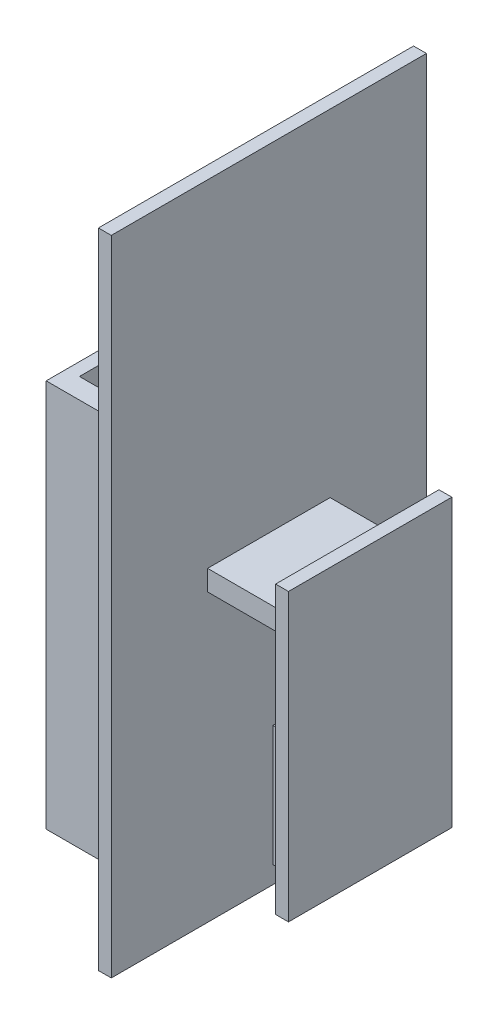
from build123d import *

# Parameters (mm, degrees)
EXTRUDE_1_DEPTH      = 0.8
EXTRUDE_1_DEPTH_BACK = 0.8
SKETCH_1_W           = 39.2
SKETCH_1_H           = 80
SKETCH_1_3_W         = 15.24
SKETCH_1_3_H         = 2.54
EXTRUDE_2_DEPTH      = 11.8
SKETCH_2_W           = 20.32
SKETCH_2_H           = 35.6
EXTRUDE_3_DEPTH      = 1.6
SKETCH_2_3_W         = 15
SKETCH_2_3_H         = 15
EXTRUDE_4_DEPTH      = 3
SKETCH_1_4_W         = 2.54
SKETCH_1_4_H         = 48.3
EXTRUDE_6_DEPTH      = 12.6
EXTRUDE_7_DEPTH      = 1.6
SKETCH_3_3_W         = 6
SKETCH_3_3_H         = 6
EXTRUDE_8_DEPTH      = 4.6


with BuildPart() as part:
    # 草圖1 → 填料-伸長1 (new, two sides: drawn at the far end of the back side and taken through both)
    with BuildSketch(Plane(origin=(0, 0, 0), x_dir=(0, 0, -1), z_dir=(1, 0, 0)).offset(-EXTRUDE_1_DEPTH_BACK)):
        Rectangle(SKETCH_1_W, SKETCH_1_H)
    extrude(amount=EXTRUDE_1_DEPTH + EXTRUDE_1_DEPTH_BACK)

    # 草圖1<3> → 填料-伸長2 (add)
    with BuildSketch(Plane(origin=(0, 0, 0), x_dir=(0, 0, -1), z_dir=(1, 0, 0))):
        with Locations((0, -3.13)):
            Rectangle(SKETCH_1_3_W, SKETCH_1_3_H)
    extrude(amount=EXTRUDE_2_DEPTH)

    # 草圖2 → 填料-伸長3 (add)
    with BuildSketch(Plane(origin=(11.8, 0, 0), x_dir=(0, 0, -1), z_dir=(1, 0, 0))):
        with Locations((0, -14.58)):
            Rectangle(SKETCH_2_W, SKETCH_2_H)
    extrude(amount=EXTRUDE_3_DEPTH)

    # 草圖2<3> → 填料-伸長4 (add)
    with BuildSketch(Plane(origin=(11.8, 0, 0), x_dir=(0, 0, -1), z_dir=(1, 0, 0))):
        with Locations((0, -22.34)):
            Rectangle(SKETCH_2_3_W, SKETCH_2_3_H)
    extrude(amount=-EXTRUDE_4_DEPTH)

    # 草圖1<4> → 填料-伸長6 (add)
    with BuildSketch(Plane(origin=(0, 0, 0), x_dir=(0, 0, -1), z_dir=(1, 0, 0))):
        with Locations((-11.43, -10.77)):
            Rectangle(SKETCH_1_4_W, SKETCH_1_4_H)
        with Locations((11.43, -10.77)):
            Rectangle(SKETCH_1_4_W, SKETCH_1_4_H)
    extrude(amount=-EXTRUDE_6_DEPTH)

    # 草圖3 → 填料-伸長7 (add)
    with BuildSketch(Plane.ZY.offset(12.6)):
        Polygon((-12.7, -34.92), (-3, -34.92), (-3, -28.92), (3, -28.92), (3, -34.92), (12.7, -34.92), (12.7, 13.38), (-12.7, 13.38), align=None)
    extrude(amount=EXTRUDE_7_DEPTH)

    # 草圖3<3> → 填料-伸長8 (add)
    with BuildSketch(Plane.ZY.offset(12.6)):
        with Locations((0, -31.92)):
            Rectangle(SKETCH_3_3_W, SKETCH_3_3_H)
    extrude(amount=EXTRUDE_8_DEPTH)


solid = part.part
